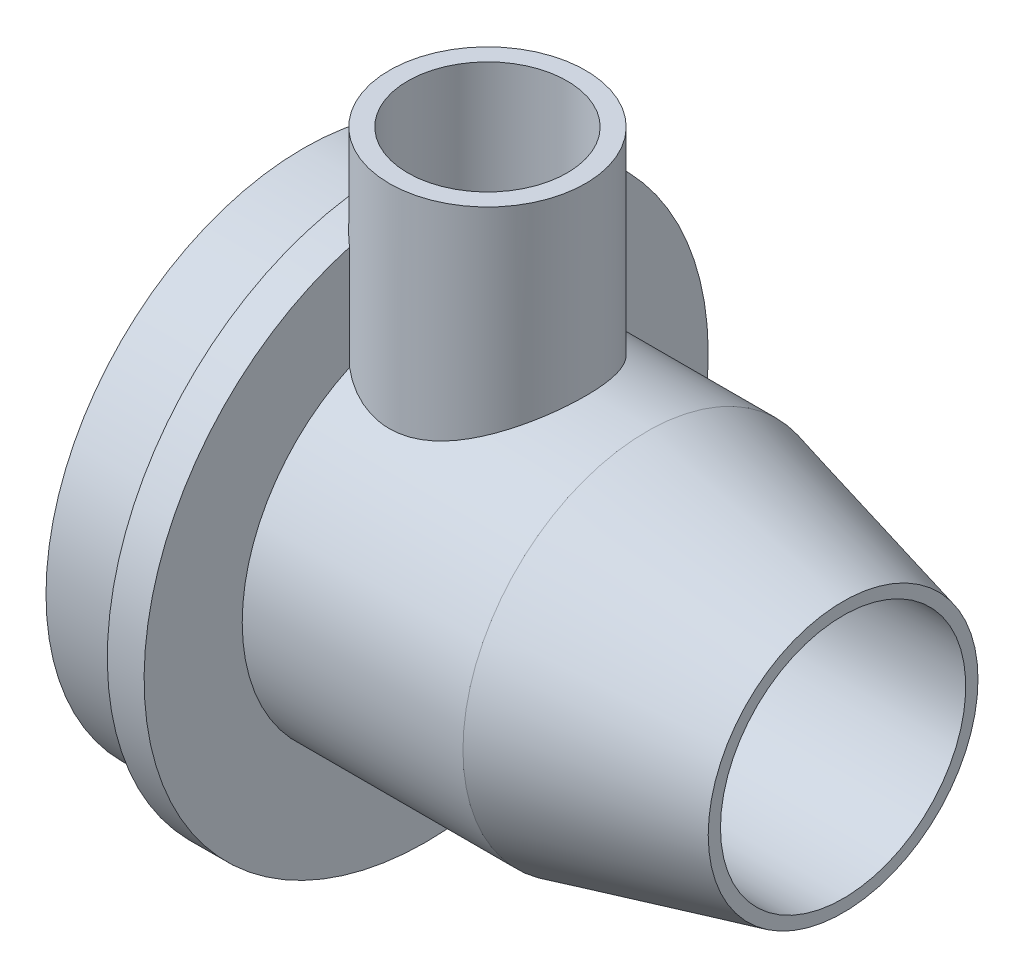
from build123d import *

# Parameters (mm, degrees)
BOSS_EXTRU_1_REACH      = 728.223
ESQUISSE3_R             = 80
ESQUISSE4_R             = 65
ENL_V_MAT_EXTRU_1_DEPTH = 280


with BuildPart() as part:
    # Esquisse1 → Révolution1 (revolve)
    with BuildSketch(Plane.XY, mode=Mode.PRIVATE) as r_volution1_sk:
        Polygon((0, 100), (440, 100), (440, 110), (280, 150), (100, 150), (100, 230), (70, 230), (70, 210), (0, 210), align=None)
    revolve(r_volution1_sk.sketch.rotate(Axis((0, 0, 0), (1, 0, 0)), 90), axis=Axis((0, 0, 0), (1, 0, 0)))

    # Esquisse3 → Boss.-Extru.1 (add, up to next)
    with BuildSketch(Plane(origin=(0, 300, 0), x_dir=(1, 0, 0), z_dir=(0, 1, 0)), mode=Mode.PRIVATE) as boss_extru_1_sk1:
        with Locations(Location((150, 0, 0), (0, 0, 270))):
            Circle(ESQUISSE3_R)
    boss_extru_1_tool1 = extrude(boss_extru_1_sk1.sketch, amount=-BOSS_EXTRU_1_REACH, mode=Mode.PRIVATE) - part.part
    add(boss_extru_1_tool1.solids().sort_by_distance((150, 300, 0))[0])

    # Esquisse4 → Enlèv. mat.-Extru.1 (cut)
    with BuildSketch(Plane(origin=(0, 300, 0), x_dir=(1, 0, 0), z_dir=(0, 1, 0))):
        with Locations(Location((150, 0, 0), (0, 0, 270))):
            Circle(ESQUISSE4_R)
    extrude(amount=-ENL_V_MAT_EXTRU_1_DEPTH, mode=Mode.SUBTRACT)


solid = part.part
